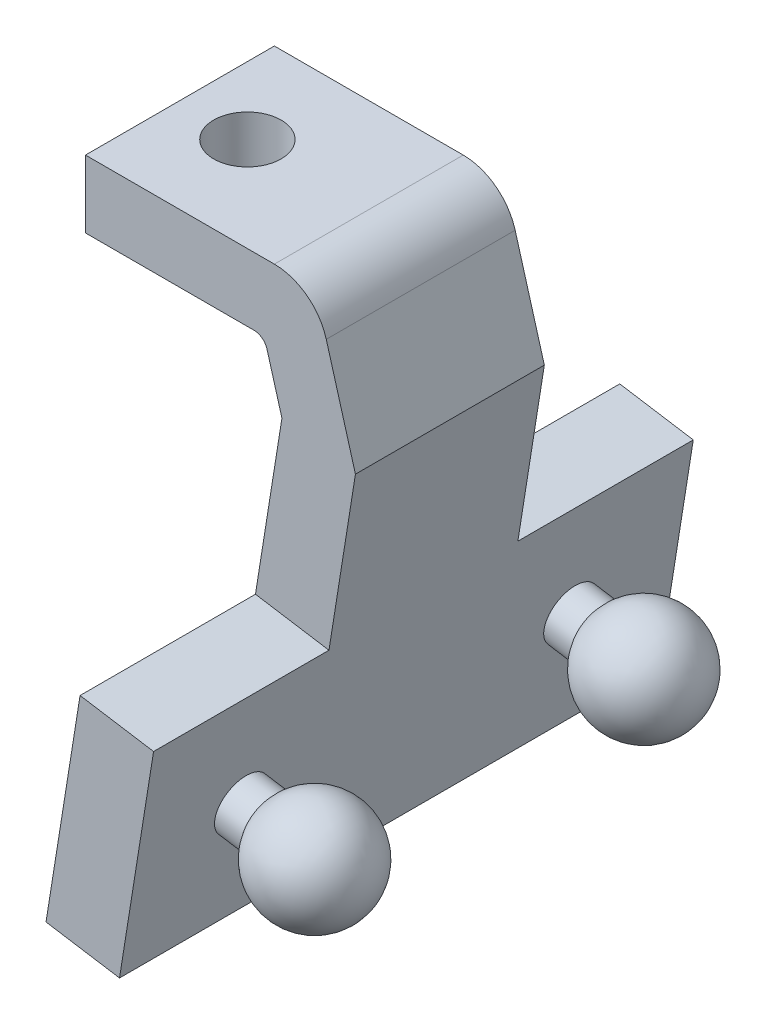
from build123d import *
from build123d.topology import SkipClean

# Parameters (mm, degrees)
EXTRUDE_1_DEPTH     = 3.5
SKETCH_2_R          = 1.25
CUT_EXTRUDE_3_DEPTH = 5.5
SKETCH_3_W          = 20
SKETCH_3_H          = 8
EXTRUDE_2_DEPTH     = 2.758445
SKETCH_4_R          = 1
EXTRUDE_3_DEPTH     = 1


with BuildPart() as part:
    # 草图1 → 凸台-拉伸1 (new, symmetric)
    with BuildSketch(Plane.XY):
        with BuildLine():
            Line((0, 0), (6.245432753, 0))
            ThreePointArc((6.245432753, 0), (6.54659813, -0.100876691), (6.72624124, -0.362802336))
            Line((6.72624124, -0.362802336), (7.280170813, -2.304045596))
            Line((7.280170813, -2.304045596), (5.037815697, -16.344304172))
            Line((5.037815697, -16.344304172), (7.761739738, -16.779339251))
            Line((7.761739738, -16.779339251), (10.004094853, -2.739080675))
            Line((10.004094853, -2.739080675), (8.923233948, 1.048790655))
            ThreePointArc((8.923233948, 1.048790655), (8.204661507, 2.096493237), (7, 2.5))
            Line((7, 2.5), (0, 2.5))
            Line((0, 2.5), (0, 0))
        make_face()
    extrude(amount=EXTRUDE_1_DEPTH, both=True)

    # 草图2 → 切除-拉伸3 (cut)
    with BuildSketch(Plane.XZ):
        with Locations((2.5, 0)):
            Circle(SKETCH_2_R)
    extrude(amount=-CUT_EXTRUDE_3_DEPTH, mode=Mode.SUBTRACT)

    # 草图3 → 凸台-拉伸2 (add)
    with SkipClean():  # the faces are left unmerged after this step: merging them gives an invalid solid
        with BuildSketch(Plane(origin=(10.181842804, -1.62613154, 0), x_dir=(0, 0, -1), z_dir=(0.9874854277803842, -0.15771027208584712, 0))):
            with Locations((0, -11.345246912)):
                Rectangle(SKETCH_3_W, SKETCH_3_H)
        extrude(amount=-EXTRUDE_2_DEPTH)

    # 草图4 → 凸台-拉伸3 (add)
    with SkipClean():  # the faces are left unmerged after this step: merging them gives an invalid solid
        with BuildSketch(Plane(origin=(10.181842804, -1.62613154, 0), x_dir=(0, 0, -1), z_dir=(0.9874854277803842, -0.15771027208584712, 0))):
            with Locations(Location((-6.099395407, -11.345246912, 0), (0, 0, 270))):
                Circle(SKETCH_4_R)
        extrude_3 = extrude(amount=EXTRUDE_3_DEPTH)

    # 草图5 → 旋转1 (revolve)
    with SkipClean():  # the faces are left unmerged after this step: merging them gives an invalid solid
        with BuildSketch(Plane(origin=(-1.789261977, -11.203266001, 0), x_dir=(-0.9874854277803842, 0.15771027208584712, 0), z_dir=(0.15771027208584712, 0.9874854277803842, 0))):
            with BuildLine():
                Line((-11.310879044, 6.099395407), (-15.042929852, 6.099395407))
                ThreePointArc((-15.042929852, 6.099395407), (-13.560567942, 8.031247059), (-11.310879044, 7.099395407))
                Line((-11.310879044, 7.099395407), (-11.310879044, 6.099395407))
            make_face()
        revolve_1 = revolve(axis=Axis((9.380066254, -12.987107812, 6.099395407), (0.987485427780384, -0.15771027208584756, 0)))

    # 镜向1: 凸台-拉伸3, 旋转1 across plane
    with SkipClean():  # the faces are left unmerged after this step: merging them gives an invalid solid
        add(extrude_3.mirror(Plane.XY))
        add(revolve_1.mirror(Plane.XY))


solid = part.part
